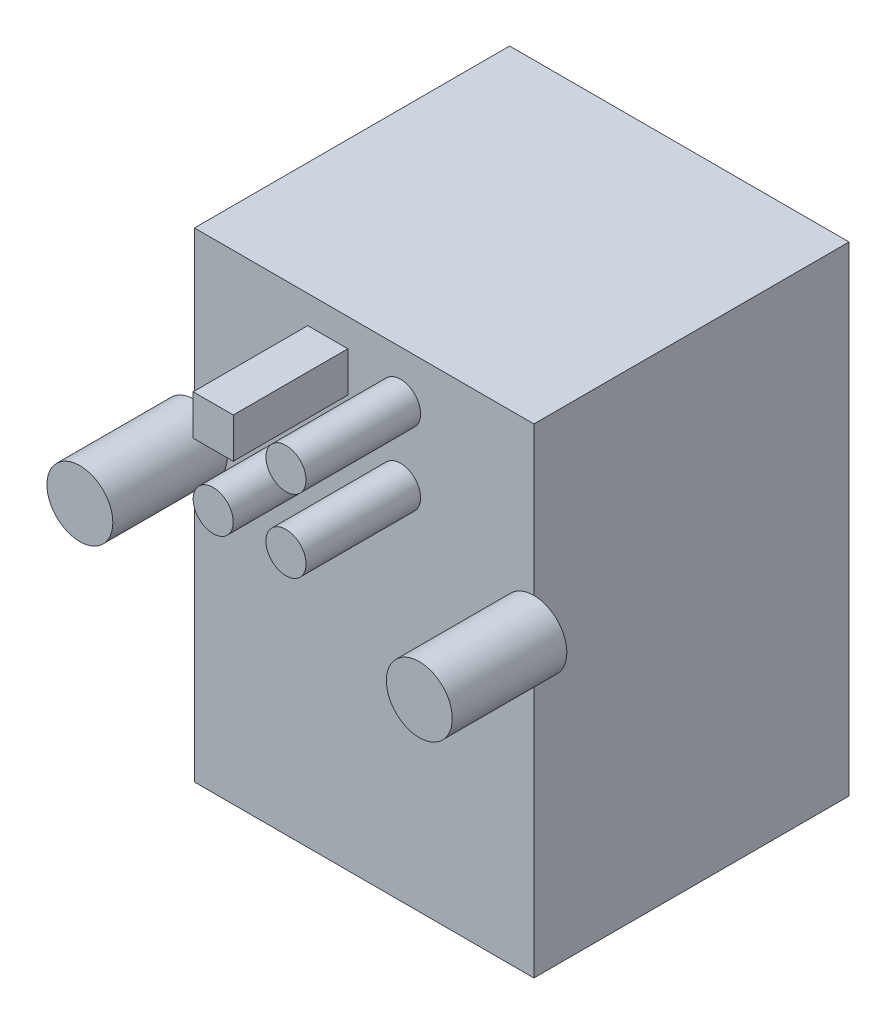
from build123d import *

# Parameters (mm, degrees)
SKETCH1_W           = 11.84764794
SKETCH1_H           = 16.748729175
BOSS_EXTRUDE1_DEPTH = 11
SKETCH1_3_R         = 1.1500104
SKETCH1_3_W         = 1.3999972
SKETCH1_3_H         = 1.3999972
SKETCH1_3_R_2       = 0.6999986
BOSS_EXTRUDE2_DEPTH = 4


with BuildPart() as part:
    # Sketch1 → Boss-Extrude1 (new body)
    with BuildSketch(Plane.XY):
        with Locations((0, -2.040885412)):
            Rectangle(SKETCH1_W, SKETCH1_H)
    extrude(amount=-BOSS_EXTRUDE1_DEPTH)

    # Sketch1<3> → Boss-Extrude2 (add)
    with BuildSketch(Plane.XY):
        with Locations((5.92382397, 0)):
            Circle(SKETCH1_3_R)
        with Locations((-5.92382397, 0)):
            Circle(SKETCH1_3_R)
        with Locations((-1.27, 4.657515676)):
            Rectangle(SKETCH1_3_W, SKETCH1_3_H)
        with Locations((1.27, 4.657515676)):
            Circle(SKETCH1_3_R_2)
        with Locations((1.27, 2.117515676)):
            Circle(SKETCH1_3_R_2)
        with Locations((-1.27, 2.117515676)):
            Circle(SKETCH1_3_R_2)
    extrude(amount=BOSS_EXTRUDE2_DEPTH)


solid = part.part
